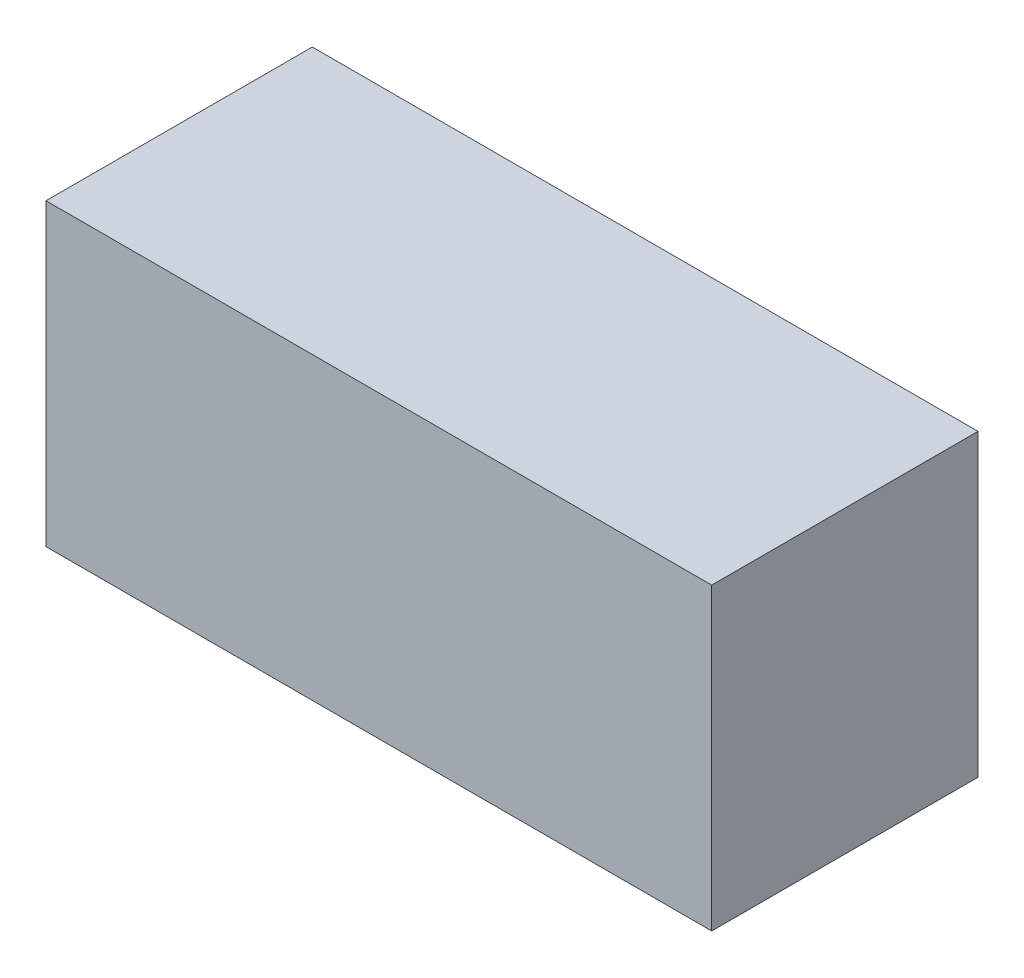
from build123d import *

# Parameters (mm, degrees)
SKETCH1_W           = 254
SKETCH1_H           = 101.6
BOSS_EXTRUDE1_DEPTH = 6.35
SKETCH5_W           = 254
SKETCH5_H           = 101.6
SKETCH5_W_2         = 241.3
SKETCH5_H_2         = 88.9
BOSS_EXTRUDE4_DEPTH = 101.6
SKETCH6_W           = 254
SKETCH6_H           = 101.6
BOSS_EXTRUDE5_DEPTH = 6.35


with BuildPart() as part:
    # Sketch1 → Boss-Extrude1 (new body)
    with BuildSketch(Plane(origin=(0, 0, 0), x_dir=(1, 0, 0), z_dir=(0, 1, 0))):
        Rectangle(SKETCH1_W, SKETCH1_H)
    extrude(amount=BOSS_EXTRUDE1_DEPTH)

    # Sketch5 → Boss-Extrude4 (add)
    with BuildSketch(Plane(origin=(0, 6.35, 0), x_dir=(1, 0, 0), z_dir=(0, 1, 0))):
        Rectangle(SKETCH5_W, SKETCH5_H)
        Rectangle(SKETCH5_W_2, SKETCH5_H_2, mode=Mode.SUBTRACT)
    extrude(amount=BOSS_EXTRUDE4_DEPTH)

    # Sketch6 → Boss-Extrude5 (add)
    with BuildSketch(Plane(origin=(0, 107.95, 0), x_dir=(1, 0, 0), z_dir=(0, 1, 0))):
        Rectangle(SKETCH6_W, SKETCH6_H)
    extrude(amount=BOSS_EXTRUDE5_DEPTH)


solid = part.part
